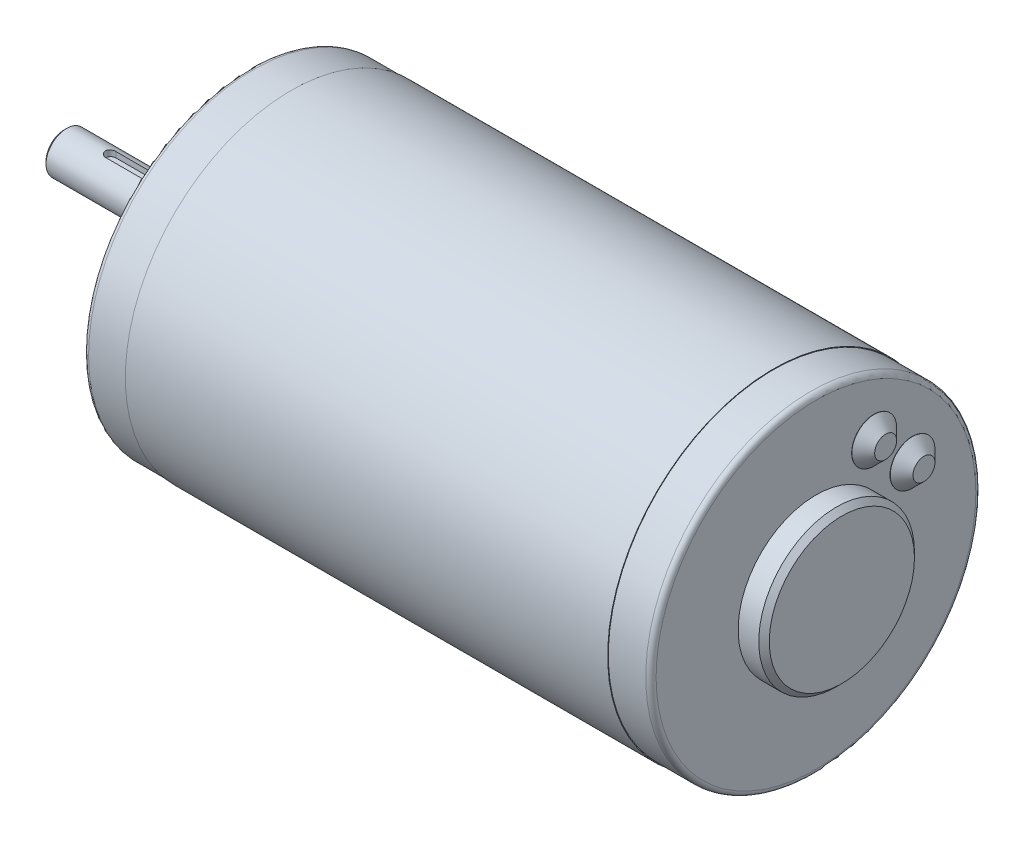
from build123d import *

# Parameters (mm, degrees)
SKETCH1_W                  = 93.1408
SKETCH1_H                  = 32.004
SKETCH2_R                  = 31.877
BOSS_EXTRUDE1_DEPTH        = 8.2296
SKETCH3_R                  = 15.0368
BOSS_EXTRUDE2_DEPTH        = 3.984
SKETCH4_R                  = 15.0368
BOSS_EXTRUDE3_DEPTH        = 1.016
BOSS_EXTRUDE3_TAPER        = 45
BOSS_EXTRUDE4_START        = 8.2296
SKETCH5_R                  = 31.877
BOSS_EXTRUDE4_DEPTH        = 8.2296
SKETCH6_R                  = 9.525
BOSS_EXTRUDE5_DEPTH        = 4
SKETCH7_R                  = 4
BOSS_EXTRUDE6_DEPTH        = 31.6
CUT_EXTRUDE1_REACH         = 125.971
CUT_EXTRUDE1_END_RADIUS    = 4
M3_5_CLEARANCE_HOLE1_D     = 4.0386
M3_5_CLEARANCE_HOLE1_DEPTH = 13.6144
M3_5_CLEARANCE_HOLE1_TIP   = 1.213317848
CHAMFER1_SIZE              = 1.016
CHAMFER2_SIZE              = 0.5
FILLET1_R                  = 1


with BuildPart() as part:
    # Sketch1 → Revolve1 (revolve)
    with BuildSketch(Plane.XY, mode=Mode.PRIVATE) as revolve1_sk:
        with Locations((54.8, 16.002)):
            Rectangle(SKETCH1_W, SKETCH1_H)
    revolve(revolve1_sk.sketch.rotate(Axis((8.2296, 0, 0), (1, 0, 0)), 270), axis=Axis((8.2296, 0, 0), (1, 0, 0)))

    # Sketch2 → Boss-Extrude1 (add)
    with BuildSketch(Plane(origin=(101.3704, 0, 0), x_dir=(0, 0, -1), z_dir=(1, 0, 0))):
        Circle(SKETCH2_R)
    extrude(amount=BOSS_EXTRUDE1_DEPTH)

    # Sketch3 → Boss-Extrude2 (add)
    with BuildSketch(Plane(origin=(109.6, 0, 0), x_dir=(0, 0, -1), z_dir=(1, 0, 0))):
        Circle(SKETCH3_R)
    extrude(amount=BOSS_EXTRUDE2_DEPTH)

    # Sketch4 → Boss-Extrude3 (add)
    with BuildSketch(Plane(origin=(113.584, 0, 0), x_dir=(0, 0, -1), z_dir=(1, 0, 0))):
        Circle(SKETCH4_R)
    extrude(amount=BOSS_EXTRUDE3_DEPTH, taper=BOSS_EXTRUDE3_TAPER)

    # Sketch5 → Boss-Extrude4 (add)
    with BuildSketch(Plane.ZY.offset(-8.2296).offset(BOSS_EXTRUDE4_START)):
        with Locations(Location((0, 0, 0), (0, 0, 180))):
            Circle(SKETCH5_R)
    extrude(amount=-BOSS_EXTRUDE4_DEPTH)

    # Sketch6 → Boss-Extrude5 (add)
    with BuildSketch(Plane.ZY):
        Circle(SKETCH6_R)
    extrude(amount=BOSS_EXTRUDE5_DEPTH)

    # Sketch7 → Boss-Extrude6 (add)
    with BuildSketch(Plane.ZY.offset(4)):
        Circle(SKETCH7_R)
    extrude(amount=BOSS_EXTRUDE6_DEPTH)

    # Cut-Extrude1: up to this cylinder (the profile starts inside it)
    cut_extrude1_end = Plane(origin=(-16.85, 0, 0), z_dir=(1, 0, 0)) * Cylinder(CUT_EXTRUDE1_END_RADIUS, 260.942, mode=Mode.PRIVATE)
    # Sketch8 → Cut-Extrude1 (cut, up to the surface)
    with BuildSketch(Plane.XZ.offset(-2.8), mode=Mode.PRIVATE) as cut_extrude1_sk1:
        with BuildLine():
            Line((-7.1, 1), (-26.6, 1))
            ThreePointArc((-26.6, 1), (-27.6, 0), (-26.6, -1))
            Line((-26.6, -1), (-7.1, -1))
            ThreePointArc((-7.1, -1), (-6.1, 0), (-7.1, 1))
        make_face()
    cut_extrude1_tool1 = extrude(cut_extrude1_sk1.sketch, amount=-CUT_EXTRUDE1_REACH, mode=Mode.PRIVATE) & cut_extrude1_end
    add(cut_extrude1_tool1.solids().sort_by_distance((-16.85, 2.8, 0))[0], mode=Mode.SUBTRACT)

    # Sketch9 → Revolve2 (revolve)
    with BuildSketch(Plane.XY.offset(-18.607090683), mode=Mode.PRIVATE) as revolve2_sk:
        Polygon((109.6, 15.525359639), (109.6, 11.207359639), (111.8479, 11.207359639), (111.8479, 13.325359639), (109.6479, 15.525359639), align=None)
    revolve(revolve2_sk.sketch.rotate(Axis((109.6, 11.207359639, -18.607090683), (1, 0, 0)), 270), axis=Axis((109.6, 11.207359639, -18.607090683), (1, 0, 0)))

    # Sketch10 → Revolve3 (revolve)
    with BuildSketch(Plane.XY.offset(-11.207359639), mode=Mode.PRIVATE) as revolve3_sk:
        Polygon((109.6, 22.925090683), (109.6, 18.607090683), (111.8479, 18.607090683), (111.8479, 20.725090683), (109.6479, 22.925090683), align=None)
    revolve(revolve3_sk.sketch.rotate(Axis((109.6, 18.607090683, -11.207359639), (1, 0, 0)), 270), axis=Axis((109.6, 18.607090683, -11.207359639), (1, 0, 0)))

    # M3.5 Clearance Hole1
    with Locations(Plane.ZY):
        with Locations((0, 25.4), (0, -25.4)):
            Hole(M3_5_CLEARANCE_HOLE1_D / 2, depth=M3_5_CLEARANCE_HOLE1_DEPTH)
            with Locations((0, 0, -(M3_5_CLEARANCE_HOLE1_DEPTH + M3_5_CLEARANCE_HOLE1_TIP / 2))):  # 118° drill point
                Cone(0, M3_5_CLEARANCE_HOLE1_D / 2, M3_5_CLEARANCE_HOLE1_TIP, mode=Mode.SUBTRACT)

    # Chamfer1
    chamfer1_edges = [part.edges().sort_by_distance(p)[0] for p in [
        (-4, 0, -9.525),
    ]]
    chamfer(chamfer1_edges, length=CHAMFER1_SIZE)

    # Chamfer2
    chamfer2_edges = [part.edges().sort_by_distance(p)[0] for p in [
        (-35.6, 0, -4),
    ]]
    chamfer(chamfer2_edges, length=CHAMFER2_SIZE)

    # Fillet1
    fillet1_edges = [part.edges().sort_by_distance(p)[0] for p in [
        (0, 0, 31.877),
        (109.6, 0, 31.877),
    ]]
    fillet(fillet1_edges, radius=FILLET1_R)


solid = part.part
